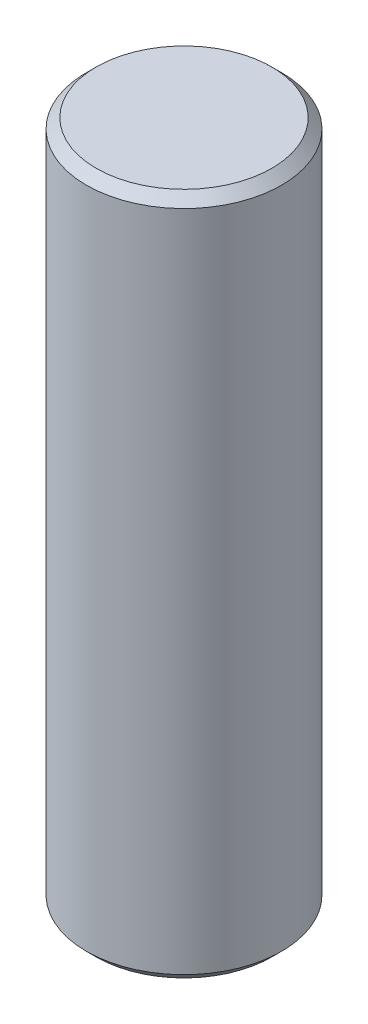
from build123d import *

# Parameters (mm, degrees)
SKETCH_1_R      = 2
EXTRUDE_1_DEPTH = 14
CHAMFER_1_SIZE  = 0.2


with BuildPart() as part:
    # 草图1 → 凸台-拉伸1 (new body)
    with BuildSketch(Plane(origin=(0, 0, 0), x_dir=(1, 0, 0), z_dir=(0, 1, 0))):
        with Locations(Location((0, 0, 0), (0, 0, 270))):
            Circle(SKETCH_1_R)
    extrude(amount=EXTRUDE_1_DEPTH)

    # 倒角1
    chamfer_1_edges = [part.edges().sort_by_distance(p)[0] for p in [
        (0, 0, -2),
        (0, 14, -2),
    ]]
    chamfer(chamfer_1_edges, length=CHAMFER_1_SIZE)


solid = part.part
